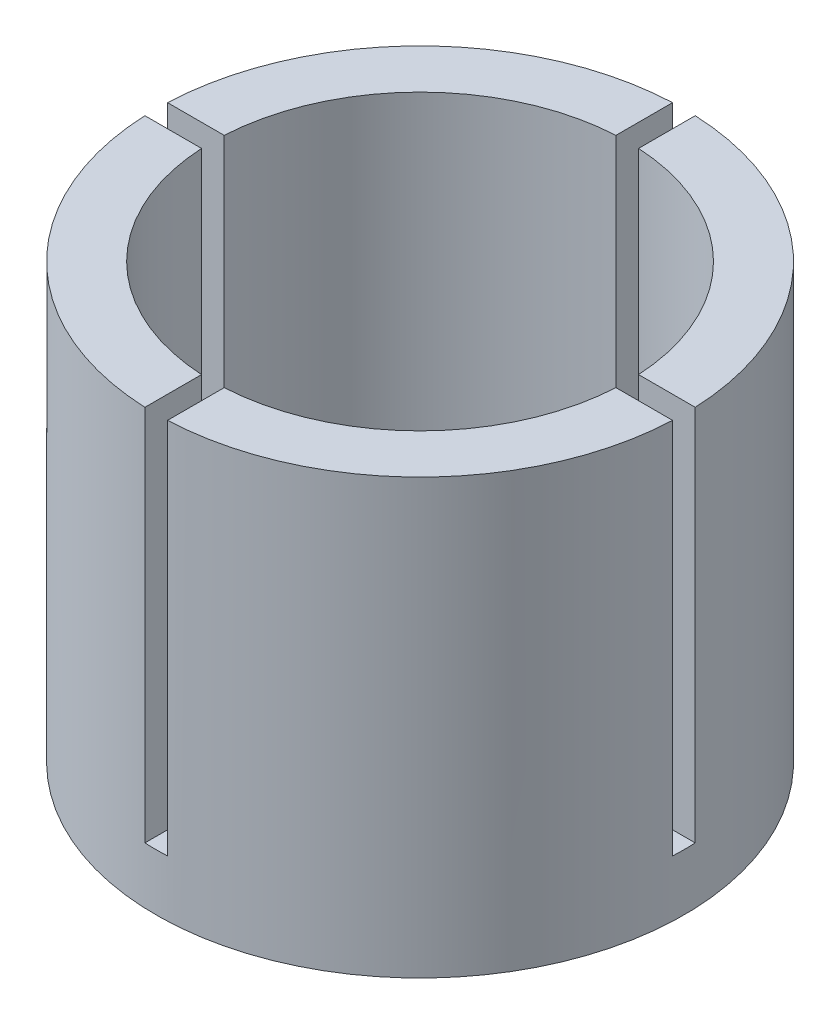
from build123d import *

# Parameters (mm, degrees)
CUT_EXTRUDE1_DEPTH = 20


with BuildPart() as part:
    # Sketch2 → Revolve1 (revolve)
    with BuildSketch(Plane.XY, mode=Mode.PRIVATE) as revolve1_sk:
        Polygon((0, 0), (14, 0), (14, 23), (11, 23), (11, 3), (7.5, 3), (7.5, 8), (0, 8), align=None)
    revolve(revolve1_sk.sketch.rotate(Axis((0, 8, 0), (0, -1, 0)), 180), axis=Axis((0, 8, 0), (0, -1, 0)))

    # Sketch3 → Cut-Extrude1 (cut)
    with BuildSketch(Plane(origin=(0, 23, 0), x_dir=(1, 0, 0), z_dir=(0, 1, 0))):
        with BuildLine():
            ThreePointArc((-0.6, -13.987136948), (-0.300068933, -13.996783868), (0, -14))
            ThreePointArc((0, -14), (0.300068933, -13.996783868), (0.6, -13.987136948))
            Line((0.6, -13.987136948), (0.6, -10.983624174))
            ThreePointArc((0.6, -10.983624174), (0, -11), (-0.6, -10.983624174))
            Line((-0.6, -10.983624174), (-0.6, -13.987136948))
        make_face()
        with BuildLine():
            Line((-0.6, 13.987136948), (-0.6, 10.983624174))
            ThreePointArc((-0.6, 10.983624174), (0, 11), (0.6, 10.983624174))
            Line((0.6, 10.983624174), (0.6, 13.987136948))
            ThreePointArc((0.6, 13.987136948), (0.300068933, 13.996783868), (0, 14))
            ThreePointArc((0, 14), (-0.300068933, 13.996783868), (-0.6, 13.987136948))
        make_face()
        with BuildLine():
            ThreePointArc((-14, 5.1e-08), (-13.996783868, -0.300068907), (-13.987136948, -0.6))
            Line((-13.987136948, -0.6), (-10.983624174, -0.6))
            ThreePointArc((-10.983624174, -0.6), (-11, 0), (-10.983624174, 0.6))
            Line((-10.983624174, 0.6), (-13.987136948, 0.6))
            ThreePointArc((-13.987136948, 0.6), (-13.996783867, 0.300068958), (-14, 5.1e-08))
        make_face()
        with BuildLine():
            Line((10.983624174, -0.6), (13.987136948, -0.6))
            ThreePointArc((13.987136948, -0.6), (13.996783868, -0.300068933), (14, 0))
            ThreePointArc((14, 0), (13.996783868, 0.300068933), (13.987136948, 0.6))
            Line((13.987136948, 0.6), (10.983624174, 0.6))
            ThreePointArc((10.983624174, 0.6), (10.995905281, 0.300111716), (11, 0))
            ThreePointArc((11, 0), (10.995905281, -0.300111716), (10.983624174, -0.6))
        make_face()
    extrude(amount=-CUT_EXTRUDE1_DEPTH, mode=Mode.SUBTRACT)


solid = part.part
